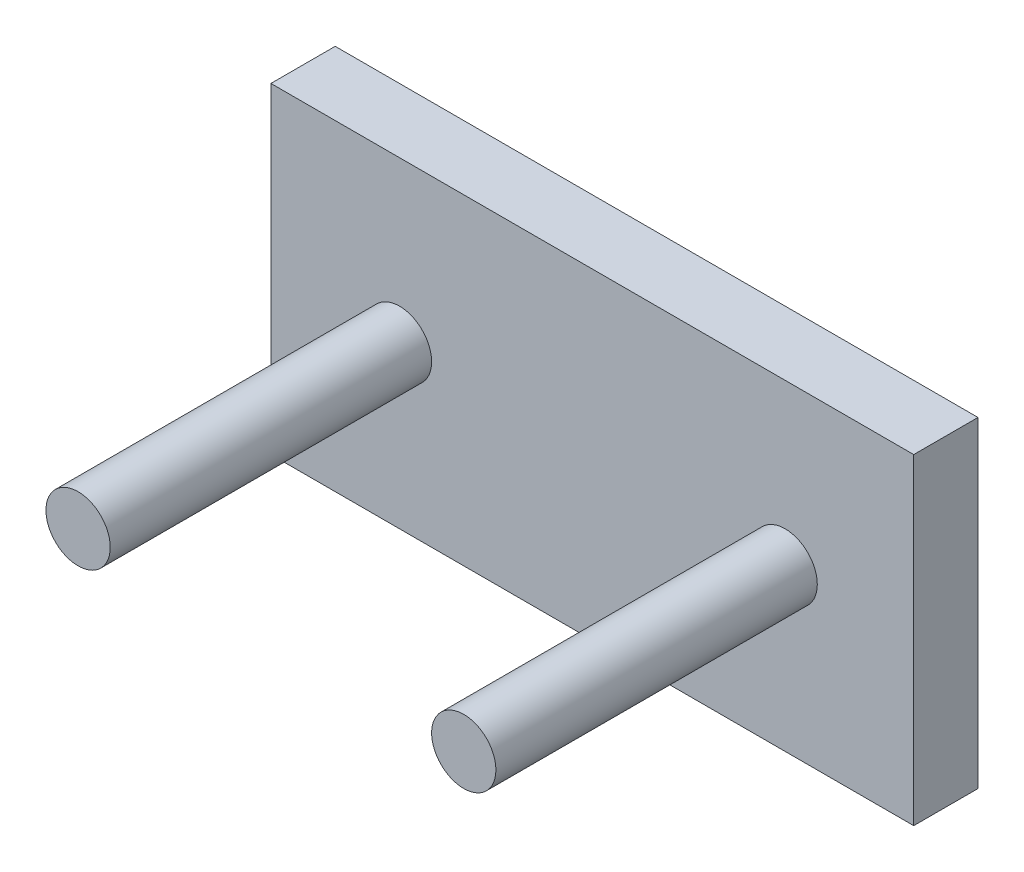
from build123d import *

# Parameters (mm, degrees)
SKETCH1_W           = 100
SKETCH1_H           = 50
BOSS_EXTRUDE1_DEPTH = 10
SKETCH1_3_R         = 5
BOSS_EXTRUDE2_DEPTH = 60


with BuildPart() as part:
    # Sketch1 → Boss-Extrude1 (new body)
    with BuildSketch(Plane.XY):
        Rectangle(SKETCH1_W, SKETCH1_H)
    extrude(amount=BOSS_EXTRUDE1_DEPTH)

    # Sketch1<3> → Boss-Extrude2 (add)
    with BuildSketch(Plane.XY):
        with Locations((-30, 0)):
            Circle(SKETCH1_3_R)
        with Locations((30, 0)):
            Circle(SKETCH1_3_R)
    extrude(amount=BOSS_EXTRUDE2_DEPTH)


solid = part.part
